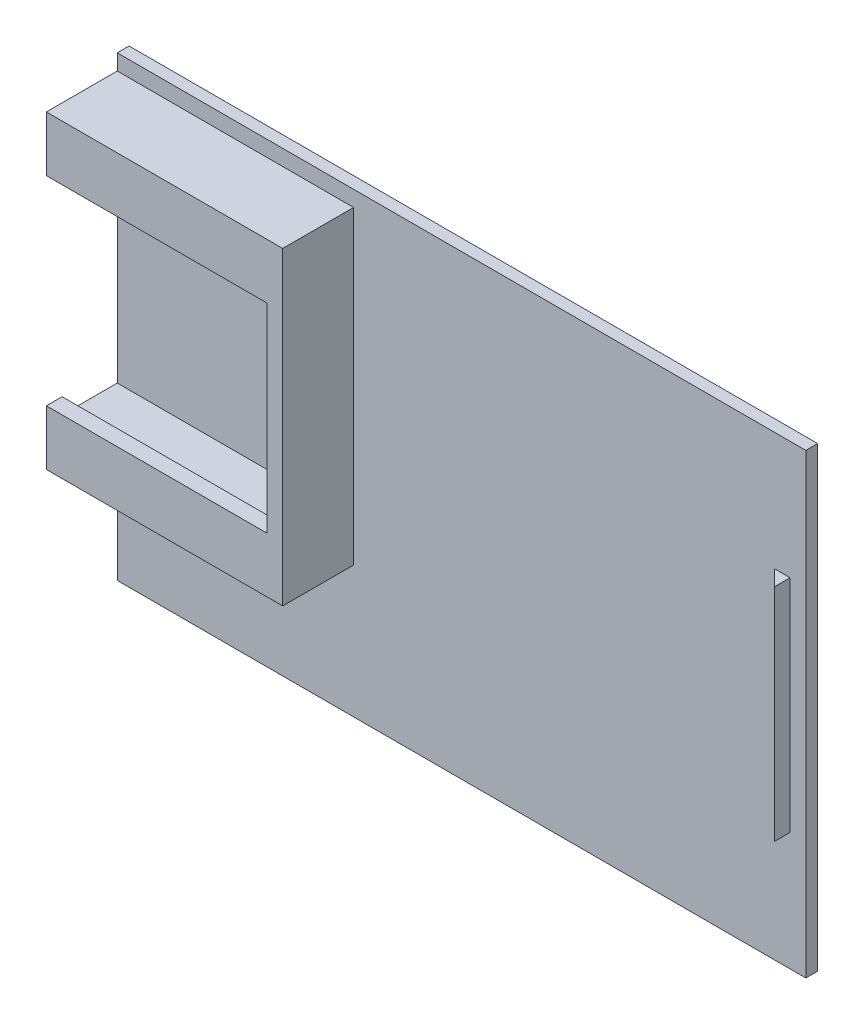
from build123d import *

# Parameters (mm, degrees)
SKETCH_1_W          = 87.4
SKETCH_1_H          = 58
EXTRUDE_1_DEPTH     = 2
EXTRUDE_2_DEPTH     = 9
SKETCH_3_W          = 2
SKETCH_3_H          = 5
EXTRUDE_3_DEPTH     = 28
SKETCH_4_W          = 28
SKETCH_4_H          = 3
EXTRUDE_4_DEPTH     = 5.4
EXTRUDE_7_DEPTH     = 58
SKETCH_6_W          = 14.323261058
SKETCH_6_H          = 15
CUT_EXTRUDE_2_DEPTH = 58
SKETCH_8_W          = 87.4
SKETCH_8_H          = 14.7
CUT_EXTRUDE_3_DEPTH = 35
SKETCH_9_W          = 87.4
SKETCH_9_H          = 58
EXTRUDE_8_DEPTH     = 2
EXTRUDE_9_DEPTH     = 29
SKETCH_11_W         = 8.812157776
SKETCH_11_H         = 15
CUT_EXTRUDE_4_DEPTH = 13
SKETCH_13_W         = 87.4
SKETCH_13_H         = 0.5
CUT_EXTRUDE_6_DEPTH = 200


with BuildPart() as part:
    # 草图1 → 凸台-拉伸1 (new body)
    with BuildSketch(Plane.XY):
        Rectangle(SKETCH_1_W, SKETCH_1_H)
    extrude(amount=EXTRUDE_1_DEPTH)

    # 草图2 → 凸台-拉伸2 (add)
    with BuildSketch(Plane.XY.offset(2)):
        Polygon((-43.7, -25), (-43.7, -27), (-13.7, -27), (-13.7, 12.3), (-43.7, 12.3), (-43.7, 10.3), (-15.7, 10.3), (-15.7, -25), align=None)
    extrude(amount=EXTRUDE_2_DEPTH)

    # 草图3 → 凸台-拉伸3 (add)
    with BuildSketch(Plane.ZY.offset(15.7)):
        with Locations((10, 7.8)):
            Rectangle(SKETCH_3_W, SKETCH_3_H)
        with Locations((10, -22.5)):
            Rectangle(SKETCH_3_W, SKETCH_3_H)
    extrude(amount=EXTRUDE_3_DEPTH)

    # 草图4 → 凸台-拉伸4 (add)
    with BuildSketch(Plane.XY.offset(2)):
        with Locations((-29.7, 8.8)):
            Rectangle(SKETCH_4_W, SKETCH_4_H)
        with Locations((-29.7, -23.5)):
            Rectangle(SKETCH_4_W, SKETCH_4_H)
    extrude(amount=EXTRUDE_4_DEPTH)

    # 草图5 → 凸台-拉伸7 (add)
    with BuildSketch(Plane.XZ.offset(29)):
        Polygon((39.7, 2), (41.7, 4), (41.7, 2), align=None)
    extrude(amount=-EXTRUDE_7_DEPTH)

    # 草图6 → 切除-拉伸2 (cut)
    with BuildSketch(Plane.XY.offset(2)):
        with Locations((36.538369471, -21.5)):
            Rectangle(SKETCH_6_W, SKETCH_6_H)
        with Locations((36.538369471, 21.5)):
            Rectangle(SKETCH_6_W, SKETCH_6_H)
    extrude(amount=CUT_EXTRUDE_2_DEPTH, mode=Mode.SUBTRACT)

    # 草图8 → 切除-拉伸3 (cut)
    with BuildSketch(Plane.XY.offset(2)):
        with Locations((0, 21.65)):
            Rectangle(SKETCH_8_W, SKETCH_8_H)
    extrude(amount=-CUT_EXTRUDE_3_DEPTH, mode=Mode.SUBTRACT)

    # 草图9 → 凸台-拉伸8 (add)
    with BuildSketch(Plane(origin=(0, 0, 0), x_dir=(-1, 0, 0), z_dir=(0, 0, -1))):
        with Locations((0, -14.7)):
            Rectangle(SKETCH_9_W, SKETCH_9_H)
    extrude(amount=-EXTRUDE_8_DEPTH)

    # 草图10 → 凸台-拉伸9 (add)
    with BuildSketch(Plane.XZ.offset(14)):
        Polygon((41.7, 4), (41.7, 2), (39.7, 2), align=None)
    extrude(amount=EXTRUDE_9_DEPTH)

    # 草图11 → 切除-拉伸4 (cut)
    with BuildSketch(Plane.XY.offset(2)):
        with Locations((39.293921112, 6.8)):
            Rectangle(SKETCH_11_W, SKETCH_11_H)
        with Locations((39.293921112, -36.2)):
            Rectangle(SKETCH_11_W, SKETCH_11_H)
    extrude(amount=CUT_EXTRUDE_4_DEPTH, mode=Mode.SUBTRACT)

    # 草图13 → 切除-拉伸6 (cut)
    with BuildSketch(Plane(origin=(0, 14.3, 0), x_dir=(1, 0, 0), z_dir=(0, 1, 0))):
        with Locations((0, -0.25)):
            Rectangle(SKETCH_13_W, SKETCH_13_H)
    extrude(amount=-CUT_EXTRUDE_6_DEPTH, mode=Mode.SUBTRACT)


solid = part.part
